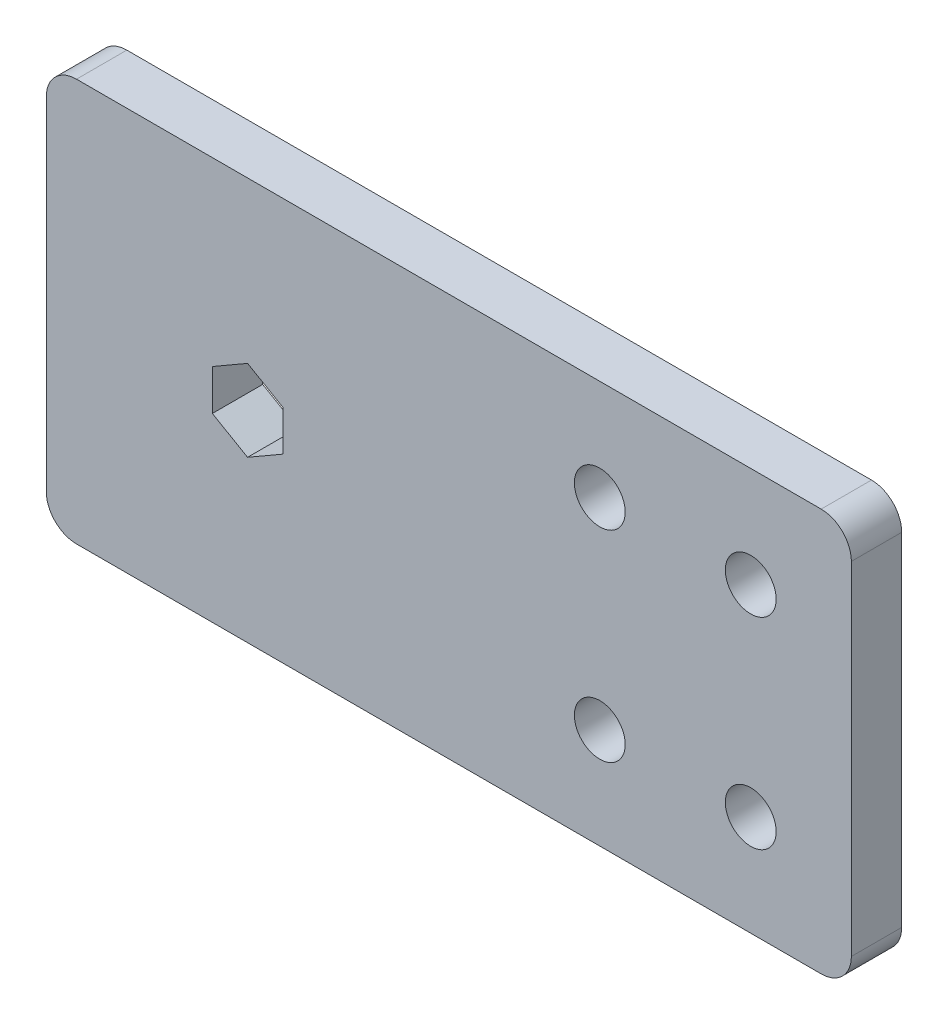
from build123d import *

# Parameters (mm, degrees)
BOSS_EXTRUDE1_DEPTH = 5
CUT_EXTRUDE1_REACH  = 91.582
CUT_EXTRUDE2_REACH  = 91.582
SKETCH3_R           = 2.525
FILLET1_R           = 3
FILLET2_R           = 3


with BuildPart() as part:
    # Sketch1 → Boss-Extrude1 (new body)
    with BuildSketch(Plane.XY):
        Polygon((20, 40), (80, 40), (80, 0), (20, 0), (0, 0), (0, 20), (0, 40), align=None)
    extrude(amount=BOSS_EXTRUDE1_DEPTH)

    # Sketch2 → Cut-Extrude1 (cut, up to next)
    with BuildSketch(Plane.XY.offset(5), mode=Mode.PRIVATE) as cut_extrude1_sk1:
        Polygon((20, 15.958548116), (23.5, 17.979274058), (23.5, 22.020725942), (20, 24.041451884), (16.5, 22.020725942), (16.5, 17.979274058), align=None)
    cut_extrude1_tool1 = extrude(cut_extrude1_sk1.sketch, amount=-CUT_EXTRUDE1_REACH, mode=Mode.PRIVATE) & part.part
    add(cut_extrude1_tool1.solids().sort_by_distance((20, 20, 5))[0], mode=Mode.SUBTRACT)

    # Sketch3 → Cut-Extrude2 (cut, up to next)
    with BuildSketch(Plane.XY.offset(5), mode=Mode.PRIVATE) as cut_extrude2_sk1:
        with Locations((55, 30)):
            Circle(SKETCH3_R)
    cut_extrude2_tool1 = extrude(cut_extrude2_sk1.sketch, amount=-CUT_EXTRUDE2_REACH, mode=Mode.PRIVATE) & part.part
    # Sketch3 → Cut-Extrude2 (cut, up to next)
    with BuildSketch(Plane.XY.offset(5), mode=Mode.PRIVATE) as cut_extrude2_sk2:
        with Locations((55, 10)):
            Circle(SKETCH3_R)
    cut_extrude2_tool2 = extrude(cut_extrude2_sk2.sketch, amount=-CUT_EXTRUDE2_REACH, mode=Mode.PRIVATE) & part.part
    # Sketch3 → Cut-Extrude2 (cut, up to next)
    with BuildSketch(Plane.XY.offset(5), mode=Mode.PRIVATE) as cut_extrude2_sk3:
        with Locations((70, 30)):
            Circle(SKETCH3_R)
    cut_extrude2_tool3 = extrude(cut_extrude2_sk3.sketch, amount=-CUT_EXTRUDE2_REACH, mode=Mode.PRIVATE) & part.part
    # Sketch3 → Cut-Extrude2 (cut, up to next)
    with BuildSketch(Plane.XY.offset(5), mode=Mode.PRIVATE) as cut_extrude2_sk4:
        with Locations((70, 10)):
            Circle(SKETCH3_R)
    cut_extrude2_tool4 = extrude(cut_extrude2_sk4.sketch, amount=-CUT_EXTRUDE2_REACH, mode=Mode.PRIVATE) & part.part
    add(cut_extrude2_tool1.solids().sort_by_distance((55, 30, 5))[0], mode=Mode.SUBTRACT)
    add(cut_extrude2_tool2.solids().sort_by_distance((55, 10, 5))[0], mode=Mode.SUBTRACT)
    add(cut_extrude2_tool3.solids().sort_by_distance((70, 30, 5))[0], mode=Mode.SUBTRACT)
    add(cut_extrude2_tool4.solids().sort_by_distance((70, 10, 5))[0], mode=Mode.SUBTRACT)

    # Fillet1
    fillet1_edges = [part.edges().sort_by_distance(p)[0] for p in [
        (80, 40, 2.5),
        (80, 0, 2.5),
    ]]
    fillet(fillet1_edges, radius=FILLET1_R)

    # Fillet2
    fillet2_edges = [part.edges().sort_by_distance(p)[0] for p in [
        (0, 0, 2.5),
        (0, 40, 2.5),
    ]]
    fillet(fillet2_edges, radius=FILLET2_R)


solid = part.part
